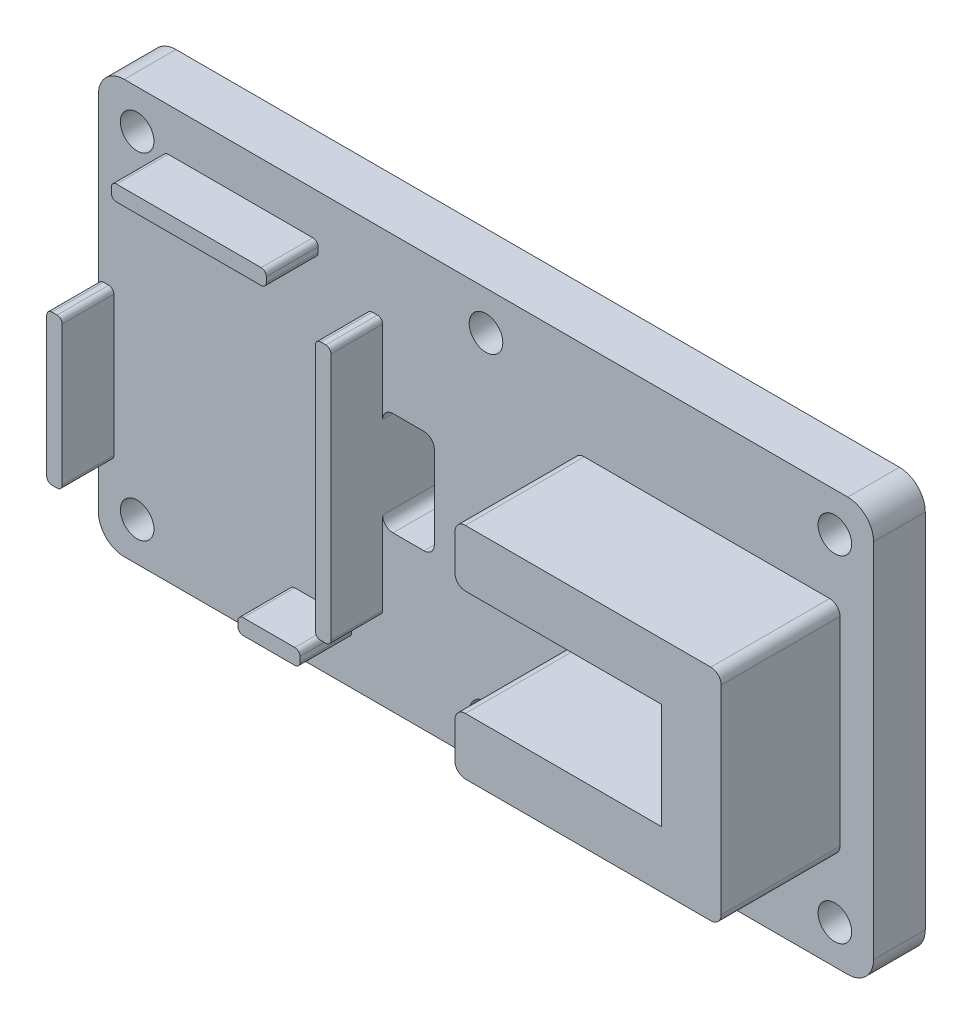
from build123d import *

# Parameters (mm, degrees)
SKETCH1_W            = 150
SKETCH1_H            = 80
SKETCH1_W_2          = 10
SKETCH1_H_2          = 20
BOSS_EXTRUDE1_DEPTH  = 10
FILLET1_R            = 2
FILLET2_R            = 5
BOSS_EXTRUDE2_DEPTH  = 23
SKETCH2_3_W          = 34.5
SKETCH2_3_H          = 20.5
CUT_EXTRUDE1_DEPTH   = 10
SKETCH3_W            = 5
SKETCH3_H            = 20.5
SKETCH3_R            = 1.1
BOSS_EXTRUDE3_DEPTH  = 3
CUT_EXTRUDE2_REACH   = 101.569
SKETCH7_W            = 5
SKETCH7_H            = 20.5
CUT_EXTRUDE3_DEPTH   = 1
SKETCH14_W           = 23
SKETCH14_H           = 11
CUT_EXTRUDE4_DEPTH   = 6
FILLET4_R            = 1
SKETCH15_R           = 3.25
CUT_EXTRUDE5_DEPTH   = 10
BOSS_EXTRUDE8_DEPTH  = 15
SKETCH16_3_W         = 19
SKETCH16_3_H         = 5
BOSS_EXTRUDE9_DEPTH  = 5
SKETCH17_R           = 1.7
CUT_EXTRUDE6_DEPTH   = 4
FILLET10_R           = 2
FILLET11_R           = 2
SKETCH18_W           = 67.5
SKETCH18_H           = 65
CUT_EXTRUDE7_DEPTH   = 89.056799851
SKETCH20_W           = 3
SKETCH20_H           = 50
BOSS_EXTRUDE11_DEPTH = 10
FILLET13_R           = 1
FILLET14_R           = 1
CUT_EXTRUDE8_REACH   = 160.71
SKETCH21_W           = 10
SKETCH21_H           = 30
FILLET15_R           = 1
SKETCH22_W           = 30
SKETCH22_H           = 3
SKETCH22_W_2         = 12
BOSS_EXTRUDE12_DEPTH = 10
FILLET16_R           = 1
FILLET17_R           = 1
FILLET18_R           = 2


with BuildPart() as part:
    # Sketch1 → Boss-Extrude1 (new body)
    with BuildSketch(Plane.XY):
        Rectangle(SKETCH1_W, SKETCH1_H)
        with Locations((-15, 0)):
            Rectangle(SKETCH1_W_2, SKETCH1_H_2, mode=Mode.SUBTRACT)
    extrude(amount=BOSS_EXTRUDE1_DEPTH)

    # Fillet1
    fillet1_edges = [part.edges().sort_by_distance(p)[0] for p in [
        (-10, -10, 5),
        (-10, 10, 5),
        (-20, 10, 5),
        (-20, -10, 5),
    ]]
    fillet(fillet1_edges, radius=FILLET1_R)

    # Fillet2
    fillet2_edges = [part.edges().sort_by_distance(p)[0] for p in [
        (75, -40, 5),
        (-75, -40, 5),
        (-75, 40, 5),
        (75, 40, 5),
    ]]
    fillet(fillet2_edges, radius=FILLET2_R)

    # Sketch2 → Boss-Extrude2 (add)
    with BuildSketch(Plane.XY.offset(10)):
        Polygon((57, 10.25), (57, -10.25), (22.5, -10.25), (11, -10.25), (11, -21.25), (68.5, -21.25), (68.5, 21.25), (11, 21.25), (11, 10.25), (22.5, 10.25), align=None)
    extrude(amount=BOSS_EXTRUDE2_DEPTH)

    # Sketch2<3> → Cut-Extrude1 (cut)
    with BuildSketch(Plane.XY.offset(10)):
        with Locations((39.75, 0)):
            Rectangle(SKETCH2_3_W, SKETCH2_3_H)
    extrude(amount=-CUT_EXTRUDE1_DEPTH, mode=Mode.SUBTRACT)

    # Sketch3 → Boss-Extrude3 (add)
    # profile 1 of 2: a face of its own
    with BuildSketch(Plane.XY.offset(10)):
        with Locations((25, 0)):
            Rectangle(SKETCH3_W, SKETCH3_H)
        with Locations((24.75, 8)):
            Circle(SKETCH3_R, mode=Mode.SUBTRACT)
        with Locations((24.75, -8)):
            Circle(SKETCH3_R, mode=Mode.SUBTRACT)
    # profile 2 of 2: a face of its own
    with BuildSketch(Plane.XY.offset(10)):
        with Locations((54.5, 0)):
            Rectangle(SKETCH3_W, SKETCH3_H)
        with Locations((54.75, 8)):
            Circle(SKETCH3_R, mode=Mode.SUBTRACT)
        with Locations((54.75, -8)):
            Circle(SKETCH3_R, mode=Mode.SUBTRACT)
    extrude(amount=-BOSS_EXTRUDE3_DEPTH)

    # Sketch4 → Cut-Loft2 section 0
    with BuildSketch(Plane(origin=(0, 0, 7), x_dir=(-1, 0, 0), z_dir=(0, 0, -1))):
        with BuildLine():
            Line((-22.5, 10.25), (-57, 10.25))
            Line((-57, 10.25), (-57, -10.25))
            Line((-57, -10.25), (-22.5, -10.25))
            Line((-22.5, -10.25), (-22.5, 10.25))
        make_face()
    # Sketch5 → Cut-Loft2 section 1
    with BuildSketch(Plane(origin=(0, 0, 0), x_dir=(-1, 0, 0), z_dir=(0, 0, -1))):
        with BuildLine():
            Line((-67, -18.25), (-12.5, -18.25))
            Line((-12.5, -18.25), (-12.5, 18.25))
            Line((-12.5, 18.25), (-67, 18.25))
            Line((-67, 18.25), (-67, -18.25))
        make_face()
    loft(mode=Mode.SUBTRACT)

    # Cut-Extrude2: up to this plane
    cut_extrude2_end = Plane(origin=(4.110738255, 0, -5.872483221), z_dir=(-0.5734623443633287, 0, 0.8192319205190403))
    # Sketch6 → Cut-Extrude2 (cut, up to the surface)
    with BuildSketch(Plane.ZY.offset(10), mode=Mode.PRIVATE) as cut_extrude2_sk1:
        with BuildLine():
            Line((0, 6), (0, -6))
            ThreePointArc((0, -6), (6, 0), (0, 6))
        make_face()
    cut_extrude2_tool1 = split(extrude(cut_extrude2_sk1.sketch, amount=-CUT_EXTRUDE2_REACH, mode=Mode.PRIVATE), bisect_by=cut_extrude2_end, keep=Keep.BOTH, mode=Mode.PRIVATE)
    add(cut_extrude2_tool1.solids().sort_by_distance((-10, 0, 2.546479))[0], mode=Mode.SUBTRACT)

    # Sketch7 → Cut-Extrude3 (cut)
    with BuildSketch(Plane(origin=(0, 0, 7), x_dir=(-1, 0, 0), z_dir=(0, 0, -1))):
        with Locations((-54.5, 0)):
            Rectangle(SKETCH7_W, SKETCH7_H)
        with Locations((-25, 0)):
            Rectangle(SKETCH7_W, SKETCH7_H)
    extrude(amount=-CUT_EXTRUDE3_DEPTH, mode=Mode.SUBTRACT)

    # Sketch14 → Cut-Extrude4 (cut)
    with BuildSketch(Plane.ZY.offset(-11)):
        with Locations((21.5, -15.75)):
            Rectangle(SKETCH14_W, SKETCH14_H)
        with Locations((21.5, 15.75)):
            Rectangle(SKETCH14_W, SKETCH14_H)
    extrude(amount=-CUT_EXTRUDE4_DEPTH, mode=Mode.SUBTRACT)

    # Fillet4
    fillet4_edges = [part.edges().sort_by_distance(p)[0] for p in [
        (52, 10.25, 9),
        (52, -10.25, 9),
        (27.5, -10.25, 9),
        (27.5, 10.25, 9),
    ]]
    fillet(fillet4_edges, radius=FILLET4_R)

    # Sketch15 → Cut-Extrude5 (cut)
    with BuildSketch(Plane.XY.offset(10)):
        with Locations((-67.5, 32.5)):
            Circle(SKETCH15_R)
        with Locations((0, 32.5)):
            Circle(SKETCH15_R)
        with Locations((67.5, 32.5)):
            Circle(SKETCH15_R)
        with Locations((67.5, -32.5)):
            Circle(SKETCH15_R)
        with Locations((0, -32.5)):
            Circle(SKETCH15_R)
        with Locations((-67.5, -32.5)):
            Circle(SKETCH15_R)
    extrude(amount=-CUT_EXTRUDE5_DEPTH, mode=Mode.SUBTRACT)

    # Sketch16 → Boss-Extrude8 (add)
    with BuildSketch(Plane.XY.offset(10)):
        Polygon((-49, -24.05), (-49, 24.05), (-30, 24.05), (-30, -24.05), (-30, -29.05), (-25, -29.05), (-25, 29.05), (-54, 29.05), (-54, -29.05), (-49, -29.05), align=None)
    extrude(amount=BOSS_EXTRUDE8_DEPTH)

    # Sketch16<3> → Boss-Extrude9 (add)
    with BuildSketch(Plane.XY.offset(10)):
        with Locations((-39.5, -26.55)):
            Rectangle(SKETCH16_3_W, SKETCH16_3_H)
    extrude(amount=BOSS_EXTRUDE9_DEPTH)

    # Sketch17 → Cut-Extrude6 (cut)
    with BuildSketch(Plane.XY.offset(25)):
        with Locations((-27.5, 3.05)):
            Circle(SKETCH17_R)
        with Locations((-51.5, -6.95)):
            Circle(SKETCH17_R)
    extrude(amount=-CUT_EXTRUDE6_DEPTH, mode=Mode.SUBTRACT)

    # Fillet10
    fillet10_edges = [part.edges().sort_by_distance(p)[0] for p in [
        (-30, -26.55, 15),
        (-49, -26.55, 15),
    ]]
    fillet(fillet10_edges, radius=FILLET10_R)

    # Fillet11
    fillet11_edges = [part.edges().sort_by_distance(p)[0] for p in [
        (-39.5, -29.05, 10),
        (-25, -29.05, 17.5),
        (-25, 29.05, 17.5),
        (-54, 0, 10),
        (-54, 29.05, 17.5),
        (-54, -29.05, 17.5),
        (-39.5, 29.05, 10),
        (-25, 0, 10),
    ]]
    fillet(fillet11_edges, radius=FILLET11_R)

    # Sketch18 → Cut-Extrude7 (cut, through all)
    with BuildSketch(Plane.XY.offset(10)):
        with Locations((-33.75, 0)):
            Rectangle(SKETCH18_W, SKETCH18_H)
    extrude(amount=CUT_EXTRUDE7_DEPTH, mode=Mode.SUBTRACT)

    # Sketch20 → Boss-Extrude11 (add)
    with BuildSketch(Plane.XY.offset(10)):
        with Locations((-73.5, 0)):
            Rectangle(SKETCH20_W, SKETCH20_H)
        with Locations((-21.5, 0)):
            Rectangle(SKETCH20_W, SKETCH20_H)
    extrude(amount=BOSS_EXTRUDE11_DEPTH)

    # Fillet13
    fillet13_edges = [part.edges().sort_by_distance(p)[0] for p in [
        (-75, 25, 15),
        (-75, -25, 15),
        (-72, -25, 15),
        (-72, 25, 15),
    ]]
    fillet(fillet13_edges, radius=FILLET13_R)

    # Fillet14
    fillet14_edges = [part.edges().sort_by_distance(p)[0] for p in [
        (-23, 25, 15),
        (-23, -25, 15),
        (-20, -25, 15),
        (-20, 25, 15),
    ]]
    fillet(fillet14_edges, radius=FILLET14_R)

    # Sketch21 → Cut-Extrude8 (cut, up to next)
    with BuildSketch(Plane.ZY.offset(75), mode=Mode.PRIVATE) as cut_extrude8_sk1:
        with Locations((15, 19)):
            Rectangle(SKETCH21_W, SKETCH21_H)
    cut_extrude8_tool1 = extrude(cut_extrude8_sk1.sketch, amount=-CUT_EXTRUDE8_REACH, mode=Mode.PRIVATE) & part.part
    add(cut_extrude8_tool1.solids().sort_by_distance((-75, 19, 15))[0], mode=Mode.SUBTRACT)

    # Fillet15
    fillet15_edges = [part.edges().sort_by_distance(p)[0] for p in [
        (-75, 4, 15),
        (-72, 4, 15),
    ]]
    fillet(fillet15_edges, radius=FILLET15_R)

    # Sketch22 → Boss-Extrude12 (add)
    with BuildSketch(Plane.XY.offset(10)):
        with Locations((-47.5, 30.2)):
            Rectangle(SKETCH22_W, SKETCH22_H)
        with Locations((-32, -30.2)):
            Rectangle(SKETCH22_W_2, SKETCH22_H)
    extrude(amount=BOSS_EXTRUDE12_DEPTH)

    # Fillet16
    fillet16_edges = [part.edges().sort_by_distance(p)[0] for p in [
        (-62.5, 31.7, 15),
        (-62.5, 28.7, 15),
        (-32.5, 28.7, 15),
        (-32.5, 31.7, 15),
    ]]
    fillet(fillet16_edges, radius=FILLET16_R)

    # Fillet17
    fillet17_edges = [part.edges().sort_by_distance(p)[0] for p in [
        (-38, -28.7, 15),
        (-38, -31.7, 15),
        (-26, -31.7, 15),
        (-26, -28.7, 15),
    ]]
    fillet(fillet17_edges, radius=FILLET17_R)

    # Fillet18
    fillet18_edges = [part.edges().sort_by_distance(p)[0] for p in [
        (17, -10.25, 21.5),
        (17, -21.25, 21.5),
        (17, 21.25, 21.5),
        (17, 10.25, 21.5),
        (68.5, -21.25, 21.5),
        (68.5, 21.25, 21.5),
    ]]
    fillet(fillet18_edges, radius=FILLET18_R)


solid = part.part
